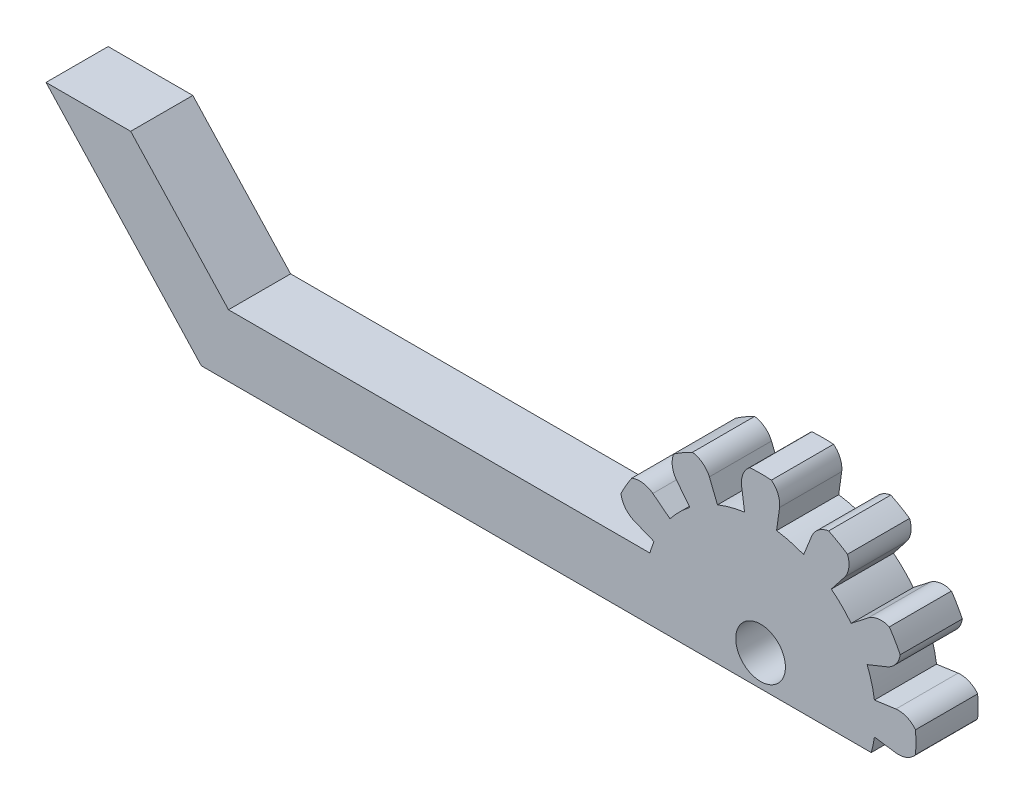
from build123d import *

# Parameters (mm, degrees)
SKETCH1_R           = 4
BOSS_EXTRUDE2_DEPTH = 10


with BuildPart() as part:
    # Sketch1 → Boss-Extrude2 (new body)
    with BuildSketch(Plane.XY):
        with BuildLine():
            Line((-101.371578153, 22), (-115, 22))
            Line((-115, 22), (-90, -5))
            Line((-90, -5), (17.811513131, -5))
            ThreePointArc((17.811513131, -5), (18.106389525, -3.79587386), (18.319959272, -2.574702368))
            Line((18.319959272, -2.574702368), (21.785897512, -3.061808221))
            ThreePointArc((21.785897512, -3.061808221), (23.533640729, -2.812333445), (24.939101256, -1.743911844))
            ThreePointArc((24.939101256, -1.743911844), (25, 0), (24.939101256, 1.743911844))
            ThreePointArc((24.939101256, 1.743911844), (23.533640729, 2.812333445), (21.785897512, 3.061808221))
            Line((21.785897512, 3.061808221), (18.319959272, 2.574702368))
            ThreePointArc((18.319959272, 2.574702368), (17.869627786, 4.788152334), (17.152901309, 6.930221978))
            Line((17.152901309, 6.930221978), (20.3980448, 8.241345055))
            ThreePointArc((20.3980448, 8.241345055), (21.786897437, 9.331268157), (22.469851157, 10.95927867))
            ThreePointArc((22.469851157, 10.95927867), (21.650635095, 12.5), (20.725939314, 13.979822587))
            ThreePointArc((20.725939314, 13.979822587), (18.974563992, 14.202372572), (17.336236579, 13.544552457))
            Line((17.336236579, 13.544552457), (14.578198942, 11.389737294))
            ThreePointArc((14.578198942, 11.389737294), (13.081475452, 13.081475452), (11.389737294, 14.578198942))
            Line((11.389737294, 14.578198942), (13.544552457, 17.336236579))
            ThreePointArc((13.544552457, 17.336236579), (14.202372572, 18.974563992), (13.979822587, 20.725939314))
            ThreePointArc((13.979822587, 20.725939314), (12.5, 21.650635095), (10.95927867, 22.469851157))
            ThreePointArc((10.95927867, 22.469851157), (9.331268157, 21.786897437), (8.241345055, 20.3980448))
            Line((8.241345055, 20.3980448), (6.930221978, 17.152901309))
            ThreePointArc((6.930221978, 17.152901309), (4.788152334, 17.869627786), (2.574702368, 18.319959272))
            Line((2.574702368, 18.319959272), (3.061808221, 21.785897512))
            ThreePointArc((3.061808221, 21.785897512), (2.812333445, 23.533640729), (1.743911844, 24.939101256))
            ThreePointArc((1.743911844, 24.939101256), (0, 25), (-1.743911844, 24.939101256))
            ThreePointArc((-1.743911844, 24.939101256), (-2.812333445, 23.533640729), (-3.061808221, 21.785897512))
            Line((-3.061808221, 21.785897512), (-2.574702368, 18.319959272))
            ThreePointArc((-2.574702368, 18.319959272), (-4.788152334, 17.869627786), (-6.930221978, 17.152901309))
            Line((-6.930221978, 17.152901309), (-8.241345055, 20.3980448))
            ThreePointArc((-8.241345055, 20.3980448), (-9.331268157, 21.786897437), (-10.95927867, 22.469851157))
            ThreePointArc((-10.95927867, 22.469851157), (-12.5, 21.650635095), (-13.979822587, 20.725939314))
            ThreePointArc((-13.979822587, 20.725939314), (-14.202372572, 18.974563992), (-13.544552457, 17.336236579))
            Line((-13.544552457, 17.336236579), (-11.389737294, 14.578198942))
            ThreePointArc((-11.389737294, 14.578198942), (-13.081475452, 13.081475452), (-14.578198942, 11.389737294))
            Line((-14.578198942, 11.389737294), (-17.336236579, 13.544552457))
            ThreePointArc((-17.336236579, 13.544552457), (-18.974563992, 14.202372572), (-20.725939314, 13.979822587))
            ThreePointArc((-20.725939314, 13.979822587), (-21.650635095, 12.5), (-22.469851157, 10.95927867))
            ThreePointArc((-22.469851157, 10.95927867), (-21.786897437, 9.331268157), (-20.3980448, 8.241345055))
            Line((-20.3980448, 8.241345055), (-17.152901309, 6.930221978))
            ThreePointArc((-17.152901309, 6.930221978), (-17.508826588, 5.974193795), (-17.811513131, 5))
            Line((-17.811513131, 5), (-85.630837413, 5))
            Line((-85.630837413, 5), (-101.371578153, 22))
        make_face()
        Circle(SKETCH1_R, mode=Mode.SUBTRACT)
    extrude(amount=BOSS_EXTRUDE2_DEPTH)


solid = part.part
